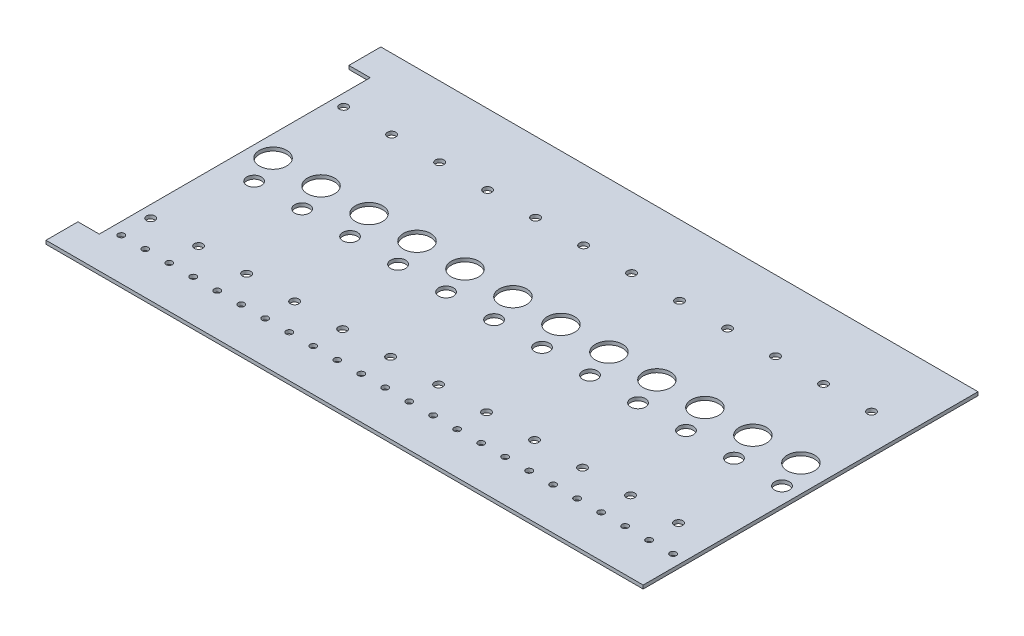
from build123d import *

# Parameters (mm, degrees)
SKETCH1_W           = 137.24989985
SKETCH1_H           = 79.804399954
SKETCH1_R           = 0.750000024
SKETCH1_R_2         = 1.000000032
SKETCH1_R_3         = 1.750000056
SKETCH1_R_4         = 3.249999977
BOSS_EXTRUDE1_DEPTH = 0.8382
SKETCH2_W           = 7.62
SKETCH2_H           = 0.8382
BOSS_EXTRUDE2_DEPTH = 5.08


with BuildPart() as part:
    # Sketch1 → Boss-Extrude1 (new body)
    with BuildSketch(Plane(origin=(0, 0, 0), x_dir=(1, 0, 0), z_dir=(0, 1, 0))):
        with Locations((68.624949925, 39.902199977)):
            Rectangle(SKETCH1_W, SKETCH1_H)
        with Locations(Location((2.859372911, 10.000000066, 0), (0, 0, 270))):
            Circle(SKETCH1_R, mode=Mode.SUBTRACT)
        with Locations(Location((8.578106711, 10.000000066, 0), (0, 0, 270))):
            Circle(SKETCH1_R, mode=Mode.SUBTRACT)
        with Locations(Location((14.296840511, 10.000000066, 0), (0, 0, 270))):
            Circle(SKETCH1_R, mode=Mode.SUBTRACT)
        with Locations(Location((20.015574311, 10.000000066, 0), (0, 0, 270))):
            Circle(SKETCH1_R, mode=Mode.SUBTRACT)
        with Locations(Location((25.734308111, 10.000000066, 0), (0, 0, 270))):
            Circle(SKETCH1_R, mode=Mode.SUBTRACT)
        with Locations(Location((31.453041911, 10.000000066, 0), (0, 0, 270))):
            Circle(SKETCH1_R, mode=Mode.SUBTRACT)
        with Locations(Location((37.171775711, 10.000000066, 0), (0, 0, 270))):
            Circle(SKETCH1_R, mode=Mode.SUBTRACT)
        with Locations(Location((42.890509511, 10.000000066, 0), (0, 0, 270))):
            Circle(SKETCH1_R, mode=Mode.SUBTRACT)
        with Locations(Location((48.609243311, 10.000000066, 0), (0, 0, 270))):
            Circle(SKETCH1_R, mode=Mode.SUBTRACT)
        with Locations(Location((54.327977111, 10.000000066, 0), (0, 0, 270))):
            Circle(SKETCH1_R, mode=Mode.SUBTRACT)
        with Locations(Location((60.046710911, 10.000000066, 0), (0, 0, 270))):
            Circle(SKETCH1_R, mode=Mode.SUBTRACT)
        with Locations(Location((65.765444711, 10.000000066, 0), (0, 0, 270))):
            Circle(SKETCH1_R, mode=Mode.SUBTRACT)
        with Locations(Location((71.484178511, 10.000000066, 0), (0, 0, 270))):
            Circle(SKETCH1_R, mode=Mode.SUBTRACT)
        with Locations(Location((77.202912311, 10.000000066, 0), (0, 0, 270))):
            Circle(SKETCH1_R, mode=Mode.SUBTRACT)
        with Locations(Location((82.921646111, 10.000000066, 0), (0, 0, 270))):
            Circle(SKETCH1_R, mode=Mode.SUBTRACT)
        with Locations(Location((88.640379911, 10.000000066, 0), (0, 0, 270))):
            Circle(SKETCH1_R, mode=Mode.SUBTRACT)
        with Locations(Location((94.359113711, 10.000000066, 0), (0, 0, 270))):
            Circle(SKETCH1_R, mode=Mode.SUBTRACT)
        with Locations(Location((100.077847511, 10.000000066, 0), (0, 0, 270))):
            Circle(SKETCH1_R, mode=Mode.SUBTRACT)
        with Locations(Location((105.796581311, 10.000000066, 0), (0, 0, 270))):
            Circle(SKETCH1_R, mode=Mode.SUBTRACT)
        with Locations(Location((111.515315111, 10.000000066, 0), (0, 0, 270))):
            Circle(SKETCH1_R, mode=Mode.SUBTRACT)
        with Locations(Location((117.234048911, 10.000000066, 0), (0, 0, 270))):
            Circle(SKETCH1_R, mode=Mode.SUBTRACT)
        with Locations(Location((122.952782711, 10.000000066, 0), (0, 0, 270))):
            Circle(SKETCH1_R, mode=Mode.SUBTRACT)
        with Locations(Location((128.671516511, 10.000000066, 0), (0, 0, 270))):
            Circle(SKETCH1_R, mode=Mode.SUBTRACT)
        with Locations(Location((134.390250311, 10.000000066, 0), (0, 0, 270))):
            Circle(SKETCH1_R, mode=Mode.SUBTRACT)
        with Locations(Location((2.859372911, 17.000000036, 0), (0, 0, 270))):
            Circle(SKETCH1_R_2, mode=Mode.SUBTRACT)
        with Locations(Location((14.296865911, 17.000000036, 0), (0, 0, 270))):
            Circle(SKETCH1_R_2, mode=Mode.SUBTRACT)
        with Locations(Location((25.734358911, 17.000000036, 0), (0, 0, 270))):
            Circle(SKETCH1_R_2, mode=Mode.SUBTRACT)
        with Locations(Location((37.171851911, 17.000000036, 0), (0, 0, 270))):
            Circle(SKETCH1_R_2, mode=Mode.SUBTRACT)
        with Locations(Location((48.609344911, 17.000000036, 0), (0, 0, 270))):
            Circle(SKETCH1_R_2, mode=Mode.SUBTRACT)
        with Locations(Location((60.046837911, 17.000000036, 0), (0, 0, 270))):
            Circle(SKETCH1_R_2, mode=Mode.SUBTRACT)
        with Locations(Location((71.484330911, 17.000000036, 0), (0, 0, 270))):
            Circle(SKETCH1_R_2, mode=Mode.SUBTRACT)
        with Locations(Location((82.921823911, 17.000000036, 0), (0, 0, 270))):
            Circle(SKETCH1_R_2, mode=Mode.SUBTRACT)
        with Locations(Location((94.359316911, 17.000000036, 0), (0, 0, 270))):
            Circle(SKETCH1_R_2, mode=Mode.SUBTRACT)
        with Locations(Location((105.796809911, 17.000000036, 0), (0, 0, 270))):
            Circle(SKETCH1_R_2, mode=Mode.SUBTRACT)
        with Locations(Location((117.234302911, 17.000000036, 0), (0, 0, 270))):
            Circle(SKETCH1_R_2, mode=Mode.SUBTRACT)
        with Locations(Location((128.671795911, 17.000000036, 0), (0, 0, 270))):
            Circle(SKETCH1_R_2, mode=Mode.SUBTRACT)
        with Locations(Location((7.52228568, 36.999999914, 0), (0, 0, 270))):
            Circle(SKETCH1_R_3, mode=Mode.SUBTRACT)
        with Locations(Location((18.959777325, 36.999999914, 0), (0, 0, 270))):
            Circle(SKETCH1_R_3, mode=Mode.SUBTRACT)
        with Locations(Location((30.397268971, 36.999999914, 0), (0, 0, 270))):
            Circle(SKETCH1_R_3, mode=Mode.SUBTRACT)
        with Locations(Location((41.834760616, 36.999999914, 0), (0, 0, 270))):
            Circle(SKETCH1_R_3, mode=Mode.SUBTRACT)
        with Locations(Location((53.272252261, 36.999999914, 0), (0, 0, 270))):
            Circle(SKETCH1_R_3, mode=Mode.SUBTRACT)
        with Locations(Location((64.709743907, 36.999999914, 0), (0, 0, 270))):
            Circle(SKETCH1_R_3, mode=Mode.SUBTRACT)
        with Locations(Location((76.147235552, 36.999999914, 0), (0, 0, 270))):
            Circle(SKETCH1_R_3, mode=Mode.SUBTRACT)
        with Locations(Location((87.584727197, 36.999999914, 0), (0, 0, 270))):
            Circle(SKETCH1_R_3, mode=Mode.SUBTRACT)
        with Locations(Location((99.022218843, 36.999999914, 0), (0, 0, 270))):
            Circle(SKETCH1_R_3, mode=Mode.SUBTRACT)
        with Locations(Location((110.459710488, 36.999999914, 0), (0, 0, 270))):
            Circle(SKETCH1_R_3, mode=Mode.SUBTRACT)
        with Locations(Location((121.897202133, 36.999999914, 0), (0, 0, 270))):
            Circle(SKETCH1_R_3, mode=Mode.SUBTRACT)
        with Locations(Location((133.334693779, 36.999999914, 0), (0, 0, 270))):
            Circle(SKETCH1_R_3, mode=Mode.SUBTRACT)
        with Locations(Location((5.033610572, 43.999999884, 0), (0, 0, 270))):
            Circle(SKETCH1_R_4, mode=Mode.SUBTRACT)
        with Locations(Location((16.471103572, 43.999999884, 0), (0, 0, 270))):
            Circle(SKETCH1_R_4, mode=Mode.SUBTRACT)
        with Locations(Location((27.908596572, 43.999999884, 0), (0, 0, 270))):
            Circle(SKETCH1_R_4, mode=Mode.SUBTRACT)
        with Locations(Location((39.346089572, 43.999999884, 0), (0, 0, 270))):
            Circle(SKETCH1_R_4, mode=Mode.SUBTRACT)
        with Locations(Location((50.783582572, 43.999999884, 0), (0, 0, 270))):
            Circle(SKETCH1_R_4, mode=Mode.SUBTRACT)
        with Locations(Location((62.221075572, 43.999999884, 0), (0, 0, 270))):
            Circle(SKETCH1_R_4, mode=Mode.SUBTRACT)
        with Locations(Location((73.658568572, 43.999999884, 0), (0, 0, 270))):
            Circle(SKETCH1_R_4, mode=Mode.SUBTRACT)
        with Locations(Location((85.096061572, 43.999999884, 0), (0, 0, 270))):
            Circle(SKETCH1_R_4, mode=Mode.SUBTRACT)
        with Locations(Location((96.533554572, 43.999999884, 0), (0, 0, 270))):
            Circle(SKETCH1_R_4, mode=Mode.SUBTRACT)
        with Locations(Location((107.971047572, 43.999999884, 0), (0, 0, 270))):
            Circle(SKETCH1_R_4, mode=Mode.SUBTRACT)
        with Locations(Location((119.408540572, 43.999999884, 0), (0, 0, 270))):
            Circle(SKETCH1_R_4, mode=Mode.SUBTRACT)
        with Locations(Location((130.846033572, 43.999999884, 0), (0, 0, 270))):
            Circle(SKETCH1_R_4, mode=Mode.SUBTRACT)
        with Locations(Location((2.859372911, 62.999999984, 0), (0, 0, 270))):
            Circle(SKETCH1_R_2, mode=Mode.SUBTRACT)
        with Locations(Location((14.296865911, 62.999999984, 0), (0, 0, 270))):
            Circle(SKETCH1_R_2, mode=Mode.SUBTRACT)
        with Locations(Location((25.734358911, 62.999999984, 0), (0, 0, 270))):
            Circle(SKETCH1_R_2, mode=Mode.SUBTRACT)
        with Locations(Location((37.171851911, 62.999999984, 0), (0, 0, 270))):
            Circle(SKETCH1_R_2, mode=Mode.SUBTRACT)
        with Locations(Location((48.609344911, 62.999999984, 0), (0, 0, 270))):
            Circle(SKETCH1_R_2, mode=Mode.SUBTRACT)
        with Locations(Location((60.046837911, 62.999999984, 0), (0, 0, 270))):
            Circle(SKETCH1_R_2, mode=Mode.SUBTRACT)
        with Locations(Location((71.484330911, 62.999999984, 0), (0, 0, 270))):
            Circle(SKETCH1_R_2, mode=Mode.SUBTRACT)
        with Locations(Location((82.921823911, 62.999999984, 0), (0, 0, 270))):
            Circle(SKETCH1_R_2, mode=Mode.SUBTRACT)
        with Locations(Location((94.359316911, 62.999999984, 0), (0, 0, 270))):
            Circle(SKETCH1_R_2, mode=Mode.SUBTRACT)
        with Locations(Location((105.796809911, 62.999999984, 0), (0, 0, 270))):
            Circle(SKETCH1_R_2, mode=Mode.SUBTRACT)
        with Locations(Location((117.234302911, 62.999999984, 0), (0, 0, 270))):
            Circle(SKETCH1_R_2, mode=Mode.SUBTRACT)
        with Locations(Location((128.671795911, 62.999999984, 0), (0, 0, 270))):
            Circle(SKETCH1_R_2, mode=Mode.SUBTRACT)
    extrude(amount=BOSS_EXTRUDE1_DEPTH)

    # Sketch2 → Boss-Extrude2 (add)
    with BuildSketch(Plane.ZY):
        with Locations((-75.994399954, 0.4191)):
            Rectangle(SKETCH2_W, SKETCH2_H)
        with Locations((-3.81, 0.4191)):
            Rectangle(SKETCH2_W, SKETCH2_H)
    extrude(amount=BOSS_EXTRUDE2_DEPTH)


solid = part.part
